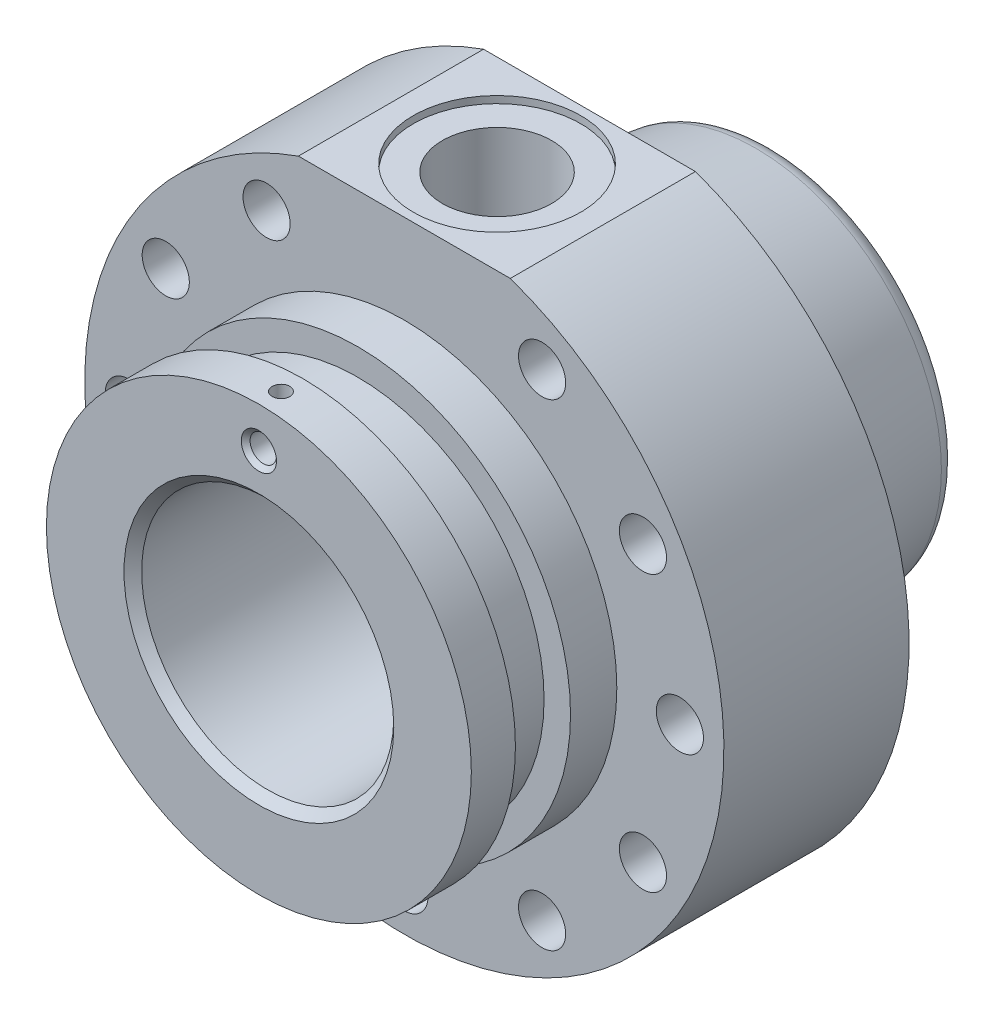
from build123d import *

# Parameters (mm, degrees)
SZKIC1_R                        = 72.5
DODANIE_WYCI_GNI_CIE1_DEPTH     = 42
SZKIC2_R                        = 48.2
DODANIE_WYCI_GNI_CIE2_DEPTH     = 33
SZKIC4_R                        = 28.6
WYTNIJ_WYCI_GNI_CIE1_DEPTH      = 156.568312969
SZKIC5_R                        = 35
WYTNIJ_WYCI_GNI_CIE2_DEPTH      = 8
SZKIC6_W                        = 12.5
SZKIC6_H                        = 6
ZAOKR_GLENIE1_R                 = 5
SZKIC7_R                        = 5.35
WYTNIJ_WYCI_GNI_CIE3_DEPTH      = 133.546218354
SZYK_KO_OWY1_COUNT              = 12
SFAZOWANIE1_SIZE                = 2
WYTNIJ_WYCI_GNI_CIE4_DEPTH      = 40
WYTNIJ_WYCI_GNI_CIE4_DEPTH_BACK = 1.6
SZKIC8_W                        = 51
SZKIC8_H                        = 59.587656766
SZKIC9_R                        = 19
WYTNIJ_WYCI_GNI_CIE5_DEPTH      = 1.6
SZKIC14_R                       = 5.35
DODANIE_WYCI_GNI_CIE4_DEPTH     = 42
SZKIC15_R                       = 12.4
WYTNIJ_WYCI_GNI_CIE6_DEPTH      = 23
WYTNIJ_WYCI_GNI_CIE7_START      = 23
SZKIC16_R                       = 19
WYTNIJ_WYCI_GNI_CIE7_DEPTH      = 23
SZKIC17_R                       = 7.5
WYTNIJ_WYCI_GNI_CIE8_DEPTH      = 23
WYTNIJ_WYCI_GNI_CIE9_REACH      = 157.568
WYTNIJ_WYCI_GNI_CIE9_END_RADIUS = 7.5
SZKIC18_R                       = 3
SFAZOWANIE2_SIZE                = 1
WYTNIJ_WYCI_GNI_CIE10_START     = 40
SZKIC19_R                       = 2
WYTNIJ_WYCI_GNI_CIE10_DEPTH     = 88.033460159


with BuildPart() as part:
    # Szkic1 → Dodanie-wyciągnięcie1 (new body)
    with BuildSketch(Plane.XY):
        with Locations(Location((0, 0, 0), (0, 0, 180))):
            Circle(SZKIC1_R)
    extrude(amount=DODANIE_WYCI_GNI_CIE1_DEPTH)

    # Szkic2 → Dodanie-wyciągnięcie2 (add)
    with BuildSketch(Plane.XY.offset(42)):
        Circle(SZKIC2_R)
    extrude(amount=DODANIE_WYCI_GNI_CIE2_DEPTH)

    # Szkic3 → Obrót1 (revolve)
    with BuildSketch(Plane(origin=(0, 0, 0), x_dir=(0, 0, -1), z_dir=(1, 0, 0)), mode=Mode.PRIVATE) as obr_t1_sk:
        Polygon((0, 47.6), (42, 41.5), (42, 28.6), (0, 28.6), align=None)
    revolve(obr_t1_sk.sketch.rotate(Axis((0, 0, 0), (0, 0, -1)), 90), axis=Axis((0, 0, 0), (0, 0, -1)))

    # Szkic4 → Wytnij-wyciągnięcie1 (cut, through all)
    with BuildSketch(Plane.XY.offset(75)):
        Circle(SZKIC4_R)
    extrude(amount=-WYTNIJ_WYCI_GNI_CIE1_DEPTH, mode=Mode.SUBTRACT)

    # Szkic5 → Wytnij-wyciągnięcie2 (cut)
    with BuildSketch(Plane(origin=(0, 0, -42), x_dir=(-1, 0, 0), z_dir=(0, 0, -1))):
        Circle(SZKIC5_R)
    extrude(amount=-WYTNIJ_WYCI_GNI_CIE2_DEPTH, mode=Mode.SUBTRACT)

    # Szkic6 → Wycięcie-obrót1 (revolve, cut)
    with BuildSketch(Plane(origin=(0, 0, 0), x_dir=(0, 0, -1), z_dir=(1, 0, 0)), mode=Mode.PRIVATE) as wyci_cie_obr_t1_sk:
        with Locations((-58.75, 45.2)):
            Rectangle(SZKIC6_W, SZKIC6_H)
    revolve(wyci_cie_obr_t1_sk.sketch.rotate(Axis((0, 0, 78.98361655), (0, 0, -1)), 90), axis=Axis((0, 0, 78.98361655), (0, 0, -1)), mode=Mode.SUBTRACT)

    # Zaokrąglenie1
    zaokr_glenie1_edges = [part.edges().sort_by_distance(p)[0] for p in [
        (-41.5, 0, -42),
    ]]
    fillet(zaokr_glenie1_edges, radius=ZAOKR_GLENIE1_R)

    # Szkic7 → Wytnij-wyciągnięcie3 (cut, through all)
    with BuildSketch(Plane.XY.offset(42)):
        with Locations((0, 62.5)):
            Circle(SZKIC7_R)
    wytnij_wyci_gni_cie3 = extrude(amount=-WYTNIJ_WYCI_GNI_CIE3_DEPTH, mode=Mode.SUBTRACT)

    # Szyk kołowy1: Wytnij-wyciągnięcie3 ×12 about axis
    szyk_ko_owy1_axis = Axis((0, 0, 0), (0, 0, 1))
    for i in range(1, SZYK_KO_OWY1_COUNT):
        add(wytnij_wyci_gni_cie3.rotate(szyk_ko_owy1_axis, i * 360 / SZYK_KO_OWY1_COUNT), mode=Mode.SUBTRACT)

    # Sfazowanie1
    sfazowanie1_edges = [part.edges().sort_by_distance(p)[0] for p in [
        (-28.6, 0, 75),
    ]]
    chamfer(sfazowanie1_edges, length=SFAZOWANIE1_SIZE)

    # Szkic8 → Wytnij-wyciągnięcie4 (cut, two sides: drawn at the far end of the back side and taken through both)
    with BuildSketch(Plane(origin=(0, 70, 0), x_dir=(1, 0, 0), z_dir=(0, 1, 0)).offset(-WYTNIJ_WYCI_GNI_CIE4_DEPTH_BACK)):
        with Locations((0, -20.8972819)):
            Rectangle(SZKIC8_W, SZKIC8_H)
    extrude(amount=WYTNIJ_WYCI_GNI_CIE4_DEPTH + WYTNIJ_WYCI_GNI_CIE4_DEPTH_BACK, mode=Mode.SUBTRACT)

    # Szkic9 → Wytnij-wyciągnięcie5 (cut)
    with BuildSketch(Plane(origin=(0, 68.4, 0), x_dir=(1, 0, 0), z_dir=(0, 1, 0))):
        with Locations(Location((0.027670653, -21, 0), (0, 0, 270))):
            Circle(SZKIC9_R)
    extrude(amount=-WYTNIJ_WYCI_GNI_CIE5_DEPTH, mode=Mode.SUBTRACT)

    # Szkic14 → Dodanie-wyciągnięcie4 (add)
    with BuildSketch(Plane.XY.offset(42)):
        with Locations((0, 62.5)):
            Circle(SZKIC14_R)
    extrude(amount=-DODANIE_WYCI_GNI_CIE4_DEPTH)

    # Szkic15 → Wytnij-wyciągnięcie6 (cut)
    with BuildSketch(Plane(origin=(0, 66.8, 0), x_dir=(1, 0, 0), z_dir=(0, 1, 0))):
        with Locations(Location((0.027670653, -21, 0), (0, 0, 270))):
            Circle(SZKIC15_R)
    extrude(amount=-WYTNIJ_WYCI_GNI_CIE6_DEPTH, mode=Mode.SUBTRACT)

    # Szkic16 → Wytnij-wyciągnięcie7 (cut)
    with BuildSketch(Plane(origin=(0, 66.8, 0), x_dir=(1, 0, 0), z_dir=(0, 1, 0)).offset(WYTNIJ_WYCI_GNI_CIE7_START)):
        with Locations(Location((0.027670653, -21, 0), (0, 0, 270))):
            Circle(SZKIC16_R)
    extrude(amount=-WYTNIJ_WYCI_GNI_CIE7_DEPTH, mode=Mode.SUBTRACT)

    # Szkic17 → Wytnij-wyciągnięcie8 (cut)
    with BuildSketch(Plane(origin=(0, 43.8, 0), x_dir=(1, 0, 0), z_dir=(0, 1, 0))):
        with Locations(Location((0.027670653, -21, 0), (0, 0, 270))):
            Circle(SZKIC17_R)
    extrude(amount=-WYTNIJ_WYCI_GNI_CIE8_DEPTH, mode=Mode.SUBTRACT)

    # Wytnij-wyciągnięcie9: up to this cylinder (the profile starts outside it)
    wytnij_wyci_gni_cie9_end = Plane(origin=(0.027670653, 39, 21), z_dir=(0, 1, 0)) * Cylinder(WYTNIJ_WYCI_GNI_CIE9_END_RADIUS, 331.136, mode=Mode.PRIVATE)
    # Szkic18 → Wytnij-wyciągnięcie9 (cut, up to the surface)
    with BuildSketch(Plane.XY.offset(75), mode=Mode.PRIVATE) as wytnij_wyci_gni_cie9_sk1:
        with Locations((0, 39)):
            Circle(SZKIC18_R)
    wytnij_wyci_gni_cie9_tool1 = extrude(wytnij_wyci_gni_cie9_sk1.sketch, amount=-WYTNIJ_WYCI_GNI_CIE9_REACH, mode=Mode.PRIVATE) - wytnij_wyci_gni_cie9_end
    add(wytnij_wyci_gni_cie9_tool1.solids().sort_by_distance((0, 39, 75))[0], mode=Mode.SUBTRACT)

    # Sfazowanie2
    sfazowanie2_edges = [part.edges().sort_by_distance(p)[0] for p in [
        (-3, 39, 75),
    ]]
    chamfer(sfazowanie2_edges, length=SFAZOWANIE2_SIZE)

    # Szkic19 → Wytnij-wyciągnięcie10 (cut, through all)
    with BuildSketch(Plane(origin=(0, 0, 0), x_dir=(1, 0, 0), z_dir=(0, 1, 0)).offset(WYTNIJ_WYCI_GNI_CIE10_START)):
        with Locations(Location((0, -70, 0), (0, 0, 90))):
            Circle(SZKIC19_R)
    extrude(amount=WYTNIJ_WYCI_GNI_CIE10_DEPTH, mode=Mode.SUBTRACT)


solid = part.part
